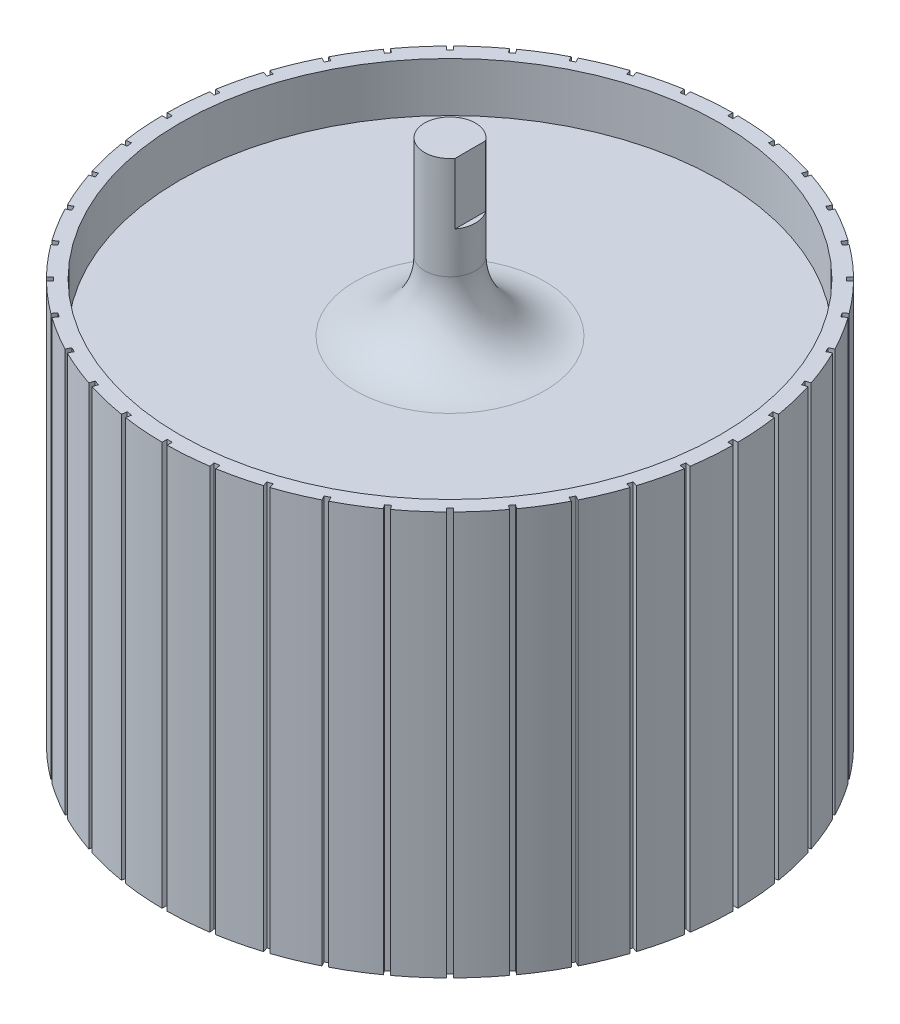
from build123d import *

# Parameters (mm, degrees)
SKETCH1_R            = 84.1375
BOSS_EXTRUDE1_DEPTH  = 62.865
FILLET1_R            = 3.175
FILLET1_OF_MIRROR1_R = 3.175
FILLET2_R            = 21.59
CUT_EXTRUDE1_DEPTH   = 19.05


with BuildPart() as part:
    # Sketch1 → Boss-Extrude1 (new, symmetric)
    with BuildSketch(Plane(origin=(0, 0, 0), x_dir=(1, 0, 0), z_dir=(0, 1, 0))):
        with BuildLine():
            Line((12.874706608, 86.361708095), (13.122491981, 87.926163366))
            ThreePointArc((13.122491981, 87.926163366), (6.97501361, 88.625950969), (0.79375, 88.896456403))
            Line((0.79375, 88.896456403), (0.79375, 87.3125))
            Line((0.79375, 87.3125), (-0.79375, 87.3125))
            Line((-0.79375, 87.3125), (-0.79375, 88.896456403))
            ThreePointArc((-0.79375, 88.896456403), (-6.97501361, 88.625950969), (-13.122491981, 87.926163366))
            Line((-13.122491981, 87.926163366), (-12.874706608, 86.361708095))
            Line((-12.874706608, 86.361708095), (-14.442661849, 86.113368382))
            Line((-14.442661849, 86.113368382), (-14.690447222, 87.677823652))
            ThreePointArc((-14.690447222, 87.677823652), (-20.753292847, 86.443685923), (-26.715614658, 84.790836377))
            Line((-26.715614658, 84.790836377), (-26.226145212, 83.284404318))
            Line((-26.226145212, 83.284404318), (-27.735947431, 82.79383984))
            Line((-27.735947431, 82.79383984), (-28.225416878, 84.300271898))
            ThreePointArc((-28.225416878, 84.300271898), (-34.020557137, 82.13289044), (-39.650910239, 79.567677591))
            Line((-39.650910239, 79.567677591), (-38.93180908, 78.156362102))
            Line((-38.93180908, 78.156362102), (-40.346281937, 77.435652184))
            Line((-40.346281937, 77.435652184), (-41.065383096, 78.846967673))
            ThreePointArc((-41.065383096, 78.846967673), (-46.450122403, 75.799710611), (-51.609868815, 72.385298513))
            Line((-51.609868815, 72.385298513), (-50.678842601, 71.103850865))
            Line((-50.678842601, 71.103850865), (-51.96315708, 70.170741777))
            Line((-51.96315708, 70.170741777), (-52.894183294, 71.452189425))
            ThreePointArc((-52.894183294, 71.452189425), (-57.735931497, 67.600090342), (-62.298021138, 63.420553153))
            Line((-62.298021138, 63.420553153), (-61.177994825, 62.30052684))
            Line((-61.177994825, 62.30052684), (-62.30052684, 61.177994825))
            Line((-62.30052684, 61.177994825), (-63.420553153, 62.298021138))
            ThreePointArc((-63.420553153, 62.298021138), (-67.600090342, 57.735931497), (-71.452189425, 52.894183294))
            Line((-71.452189425, 52.894183294), (-70.170741777, 51.96315708))
            Line((-70.170741777, 51.96315708), (-71.103850865, 50.678842601))
            Line((-71.103850865, 50.678842601), (-72.385298513, 51.609868815))
            ThreePointArc((-72.385298513, 51.609868815), (-75.799710611, 46.450122403), (-78.846967673, 41.065383096))
            Line((-78.846967673, 41.065383096), (-77.435652184, 40.346281937))
            Line((-77.435652184, 40.346281937), (-78.156362102, 38.93180908))
            Line((-78.156362102, 38.93180908), (-79.567677591, 39.650910239))
            ThreePointArc((-79.567677591, 39.650910239), (-82.13289044, 34.020557137), (-84.300271898, 28.225416878))
            Line((-84.300271898, 28.225416878), (-82.79383984, 27.735947431))
            Line((-82.79383984, 27.735947431), (-83.284404318, 26.226145212))
            Line((-83.284404318, 26.226145212), (-84.790836377, 26.715614658))
            ThreePointArc((-84.790836377, 26.715614658), (-86.443685923, 20.753292847), (-87.677823652, 14.690447222))
            Line((-87.677823652, 14.690447222), (-86.113368382, 14.442661849))
            Line((-86.113368382, 14.442661849), (-86.361708095, 12.874706608))
            Line((-86.361708095, 12.874706608), (-87.926163366, 13.122491981))
            ThreePointArc((-87.926163366, 13.122491981), (-88.625950969, 6.97501361), (-88.896456403, 0.79375))
            Line((-88.896456403, 0.79375), (-87.3125, 0.79375))
            Line((-87.3125, 0.79375), (-87.3125, -0.79375))
            Line((-87.3125, -0.79375), (-88.896456403, -0.79375))
            ThreePointArc((-88.896456403, -0.79375), (-88.625950969, -6.97501361), (-87.926163366, -13.122491981))
            Line((-87.926163366, -13.122491981), (-86.361708095, -12.874706608))
            Line((-86.361708095, -12.874706608), (-86.113368382, -14.442661849))
            Line((-86.113368382, -14.442661849), (-87.677823652, -14.690447222))
            ThreePointArc((-87.677823652, -14.690447222), (-86.443685923, -20.753292847), (-84.790836377, -26.715614658))
            Line((-84.790836377, -26.715614658), (-83.284404318, -26.226145212))
            Line((-83.284404318, -26.226145212), (-82.79383984, -27.735947431))
            Line((-82.79383984, -27.735947431), (-84.300271898, -28.225416878))
            ThreePointArc((-84.300271898, -28.225416878), (-82.13289044, -34.020557137), (-79.567677591, -39.650910239))
            Line((-79.567677591, -39.650910239), (-78.156362102, -38.93180908))
            Line((-78.156362102, -38.93180908), (-77.435652184, -40.346281937))
            Line((-77.435652184, -40.346281937), (-78.846967673, -41.065383096))
            ThreePointArc((-78.846967673, -41.065383096), (-75.799710611, -46.450122403), (-72.385298513, -51.609868815))
            Line((-72.385298513, -51.609868815), (-71.103850865, -50.678842602))
            Line((-71.103850865, -50.678842602), (-70.170741777, -51.96315708))
            Line((-70.170741777, -51.96315708), (-71.452189425, -52.894183294))
            ThreePointArc((-71.452189425, -52.894183294), (-67.600090342, -57.735931497), (-63.420553153, -62.298021138))
            Line((-63.420553153, -62.298021138), (-62.30052684, -61.177994825))
            Line((-62.30052684, -61.177994825), (-61.177994825, -62.30052684))
            Line((-61.177994825, -62.30052684), (-62.298021138, -63.420553153))
            ThreePointArc((-62.298021138, -63.420553153), (-57.735931497, -67.600090342), (-52.894183294, -71.452189425))
            Line((-52.894183294, -71.452189425), (-51.96315708, -70.170741777))
            Line((-51.96315708, -70.170741777), (-50.678842601, -71.103850865))
            Line((-50.678842601, -71.103850865), (-51.609868815, -72.385298513))
            ThreePointArc((-51.609868815, -72.385298513), (-46.450122403, -75.799710611), (-41.065383096, -78.846967673))
            Line((-41.065383096, -78.846967673), (-40.346281937, -77.435652184))
            Line((-40.346281937, -77.435652184), (-38.93180908, -78.156362102))
            Line((-38.93180908, -78.156362102), (-39.650910239, -79.567677591))
            ThreePointArc((-39.650910239, -79.567677591), (-34.020557137, -82.13289044), (-28.225416878, -84.300271898))
            Line((-28.225416878, -84.300271898), (-27.735947431, -82.79383984))
            Line((-27.735947431, -82.79383984), (-26.226145212, -83.284404318))
            Line((-26.226145212, -83.284404318), (-26.715614658, -84.790836377))
            ThreePointArc((-26.715614658, -84.790836377), (-20.753292847, -86.443685923), (-14.690447222, -87.677823652))
            Line((-14.690447222, -87.677823652), (-14.442661849, -86.113368382))
            Line((-14.442661849, -86.113368382), (-12.874706608, -86.361708095))
            Line((-12.874706608, -86.361708095), (-13.122491981, -87.926163366))
            ThreePointArc((-13.122491981, -87.926163366), (-6.97501361, -88.625950969), (-0.79375, -88.896456403))
            Line((-0.79375, -88.896456403), (-0.79375, -87.3125))
            Line((-0.79375, -87.3125), (0.79375, -87.3125))
            Line((0.79375, -87.3125), (0.79375, -88.896456403))
            ThreePointArc((0.79375, -88.896456403), (6.97501361, -88.625950969), (13.122491981, -87.926163366))
            Line((13.122491981, -87.926163366), (12.874706609, -86.361708095))
            Line((12.874706609, -86.361708095), (14.442661849, -86.113368382))
            Line((14.442661849, -86.113368382), (14.690447222, -87.677823652))
            ThreePointArc((14.690447222, -87.677823652), (20.753292847, -86.443685923), (26.715614658, -84.790836377))
            Line((26.715614658, -84.790836377), (26.226145212, -83.284404318))
            Line((26.226145212, -83.284404318), (27.735947431, -82.79383984))
            Line((27.735947431, -82.79383984), (28.225416878, -84.300271898))
            ThreePointArc((28.225416878, -84.300271898), (34.020557137, -82.13289044), (39.650910239, -79.567677591))
            Line((39.650910239, -79.567677591), (38.93180908, -78.156362102))
            Line((38.93180908, -78.156362102), (40.346281937, -77.435652184))
            Line((40.346281937, -77.435652184), (41.065383096, -78.846967673))
            ThreePointArc((41.065383096, -78.846967673), (46.450122403, -75.799710611), (51.609868815, -72.385298513))
            Line((51.609868815, -72.385298513), (50.678842602, -71.103850865))
            Line((50.678842602, -71.103850865), (51.96315708, -70.170741777))
            Line((51.96315708, -70.170741777), (52.894183294, -71.452189425))
            ThreePointArc((52.894183294, -71.452189425), (57.735931497, -67.600090342), (62.298021138, -63.420553153))
            Line((62.298021138, -63.420553153), (61.177994825, -62.30052684))
            Line((61.177994825, -62.30052684), (62.30052684, -61.177994825))
            Line((62.30052684, -61.177994825), (63.420553153, -62.298021138))
            ThreePointArc((63.420553153, -62.298021138), (67.600090342, -57.735931497), (71.452189425, -52.894183294))
            Line((71.452189425, -52.894183294), (70.170741777, -51.96315708))
            Line((70.170741777, -51.96315708), (71.103850865, -50.678842601))
            Line((71.103850865, -50.678842601), (72.385298513, -51.609868815))
            ThreePointArc((72.385298513, -51.609868815), (75.799710611, -46.450122403), (78.846967673, -41.065383096))
            Line((78.846967673, -41.065383096), (77.435652184, -40.346281937))
            Line((77.435652184, -40.346281937), (78.156362102, -38.93180908))
            Line((78.156362102, -38.93180908), (79.567677591, -39.650910239))
            ThreePointArc((79.567677591, -39.650910239), (82.13289044, -34.020557137), (84.300271898, -28.225416878))
            Line((84.300271898, -28.225416878), (82.79383984, -27.735947431))
            Line((82.79383984, -27.735947431), (83.284404318, -26.226145212))
            Line((83.284404318, -26.226145212), (84.790836377, -26.715614658))
            ThreePointArc((84.790836377, -26.715614658), (86.443685923, -20.753292847), (87.677823652, -14.690447222))
            Line((87.677823652, -14.690447222), (86.113368382, -14.442661849))
            Line((86.113368382, -14.442661849), (86.361708095, -12.874706608))
            Line((86.361708095, -12.874706608), (87.926163366, -13.122491981))
            ThreePointArc((87.926163366, -13.122491981), (88.625950969, -6.97501361), (88.896456403, -0.79375))
            Line((88.896456403, -0.79375), (87.3125, -0.79375))
            Line((87.3125, -0.79375), (87.3125, 0.79375))
            Line((87.3125, 0.79375), (88.896456403, 0.79375))
            ThreePointArc((88.896456403, 0.79375), (88.625950969, 6.97501361), (87.926163366, 13.122491981))
            Line((87.926163366, 13.122491981), (86.361708095, 12.874706608))
            Line((86.361708095, 12.874706608), (86.113368382, 14.442661849))
            Line((86.113368382, 14.442661849), (87.677823652, 14.690447222))
            ThreePointArc((87.677823652, 14.690447222), (86.443685923, 20.753292847), (84.790836377, 26.715614658))
            Line((84.790836377, 26.715614658), (83.284404318, 26.226145212))
            Line((83.284404318, 26.226145212), (82.79383984, 27.735947431))
            Line((82.79383984, 27.735947431), (84.300271898, 28.225416878))
            ThreePointArc((84.300271898, 28.225416878), (82.13289044, 34.020557137), (79.567677591, 39.650910239))
            Line((79.567677591, 39.650910239), (78.156362102, 38.93180908))
            Line((78.156362102, 38.93180908), (77.435652184, 40.346281937))
            Line((77.435652184, 40.346281937), (78.846967673, 41.065383096))
            ThreePointArc((78.846967673, 41.065383096), (75.799710611, 46.450122403), (72.385298513, 51.609868815))
            Line((72.385298513, 51.609868815), (71.103850865, 50.678842602))
            Line((71.103850865, 50.678842602), (70.170741777, 51.96315708))
            Line((70.170741777, 51.96315708), (71.452189425, 52.894183294))
            ThreePointArc((71.452189425, 52.894183294), (67.600090342, 57.735931497), (63.420553153, 62.298021138))
            Line((63.420553153, 62.298021138), (62.30052684, 61.177994825))
            Line((62.30052684, 61.177994825), (61.177994825, 62.30052684))
            Line((61.177994825, 62.30052684), (62.298021138, 63.420553153))
            ThreePointArc((62.298021138, 63.420553153), (57.735931497, 67.600090342), (52.894183294, 71.452189425))
            Line((52.894183294, 71.452189425), (51.96315708, 70.170741777))
            Line((51.96315708, 70.170741777), (50.678842602, 71.103850865))
            Line((50.678842602, 71.103850865), (51.609868815, 72.385298513))
            ThreePointArc((51.609868815, 72.385298513), (46.450122403, 75.799710611), (41.065383096, 78.846967673))
            Line((41.065383096, 78.846967673), (40.346281937, 77.435652184))
            Line((40.346281937, 77.435652184), (38.93180908, 78.156362102))
            Line((38.93180908, 78.156362102), (39.650910239, 79.567677591))
            ThreePointArc((39.650910239, 79.567677591), (34.020557137, 82.13289044), (28.225416878, 84.300271898))
            Line((28.225416878, 84.300271898), (27.735947431, 82.79383984))
            Line((27.735947431, 82.79383984), (26.226145212, 83.284404318))
            Line((26.226145212, 83.284404318), (26.715614658, 84.790836377))
            ThreePointArc((26.715614658, 84.790836377), (20.753292847, 86.443685923), (14.690447222, 87.677823652))
            Line((14.690447222, 87.677823652), (14.442661849, 86.113368382))
            Line((14.442661849, 86.113368382), (12.874706608, 86.361708095))
        make_face()
        with Locations(Location((0, 0, 0), (0, 0, 270))):
            Circle(SKETCH1_R, mode=Mode.SUBTRACT)
    extrude(amount=BOSS_EXTRUDE1_DEPTH, both=True)

    # Sketch2 → Revolve1 (revolve)
    with BuildSketch(Plane.XY):
        Polygon((0, 100.965), (0, 41.115), (-84.1375, 41.115), (-84.1375, 47.465), (-7.9375, 47.465), (-7.9375, 100.965), align=None)
    revolve1 = revolve(axis=Axis((0, 100.965, 0), (0, -1, 0)))

    # Fillet1
    fillet1_edges = [part.edges().sort_by_distance(p)[0] for p in [
        (0, 41.115, -84.1375),
    ]]
    fillet(fillet1_edges, radius=FILLET1_R)

    # Mirror1: Revolve1 across plane
    add(revolve1.mirror(Plane.ZX))

    # Fillet1 of Mirror1
    fillet1_of_mirror1_edges = [part.edges().sort_by_distance(p)[0] for p in [
        (0, -41.115, -84.1375),
    ]]
    fillet(fillet1_of_mirror1_edges, radius=FILLET1_OF_MIRROR1_R)

    # Fillet2
    fillet2_edges = [part.edges().sort_by_distance(p)[0] for p in [
        (7.9375, 47.465, 0),
        (7.9375, -47.465, 0),
    ]]
    fillet(fillet2_edges, radius=FILLET2_R)

    # Sketch4 → Cut-Extrude1 (cut)
    with BuildSketch(Plane(origin=(0, 100.965, 0), x_dir=(1, 0, 0), z_dir=(0, 1, 0))):
        with BuildLine():
            Line((6.35, 4.7625), (6.35, -4.7625))
            ThreePointArc((6.35, -4.7625), (7.9375, 0), (6.35, 4.7625))
        make_face()
    cut_extrude1 = extrude(amount=-CUT_EXTRUDE1_DEPTH, mode=Mode.SUBTRACT)

    # Mirror2: Cut-Extrude1 across plane
    add(cut_extrude1.mirror(Plane.ZX), mode=Mode.SUBTRACT)


solid = part.part
